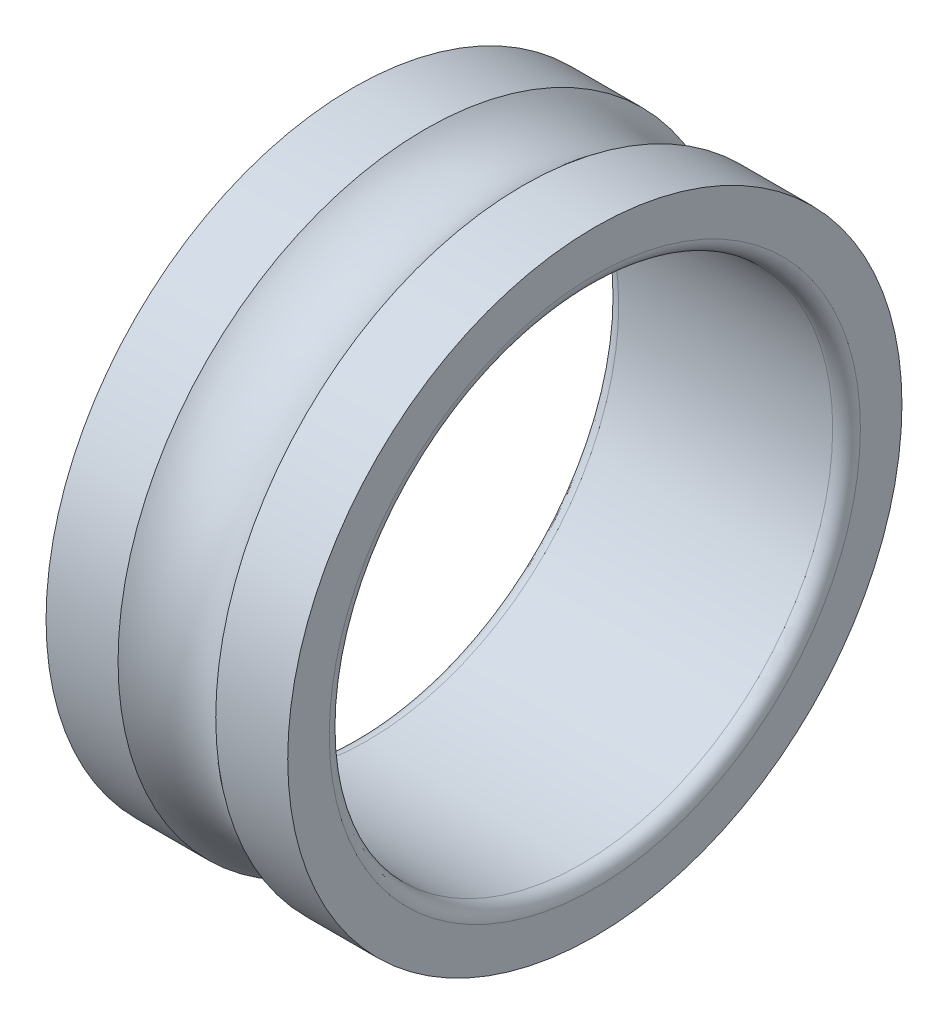
from build123d import *


with BuildPart() as part:
    # Esquisse1 → Base-Révolution (revolve)
    with BuildSketch(Plane.XY):
        with BuildLine():
            Line((-5.3125, 12.5), (5.3125, 12.5))
            ThreePointArc((5.3125, 12.5), (5.798635912, 12.701364088), (6, 13.1875))
            Line((6, 13.1875), (6, 15.25))
            Line((6, 15.25), (2.425272035, 15.25))
            ThreePointArc((2.425272035, 15.25), (0, 14.333333333), (-2.425272035, 15.25))
            Line((-2.425272035, 15.25), (-6, 15.25))
            Line((-6, 15.25), (-6, 13.1875))
            ThreePointArc((-6, 13.1875), (-5.798635912, 12.701364088), (-5.3125, 12.5))
        make_face()
    revolve(axis=Axis((0, 0, 0), (1, 0, 0)))


solid = part.part
